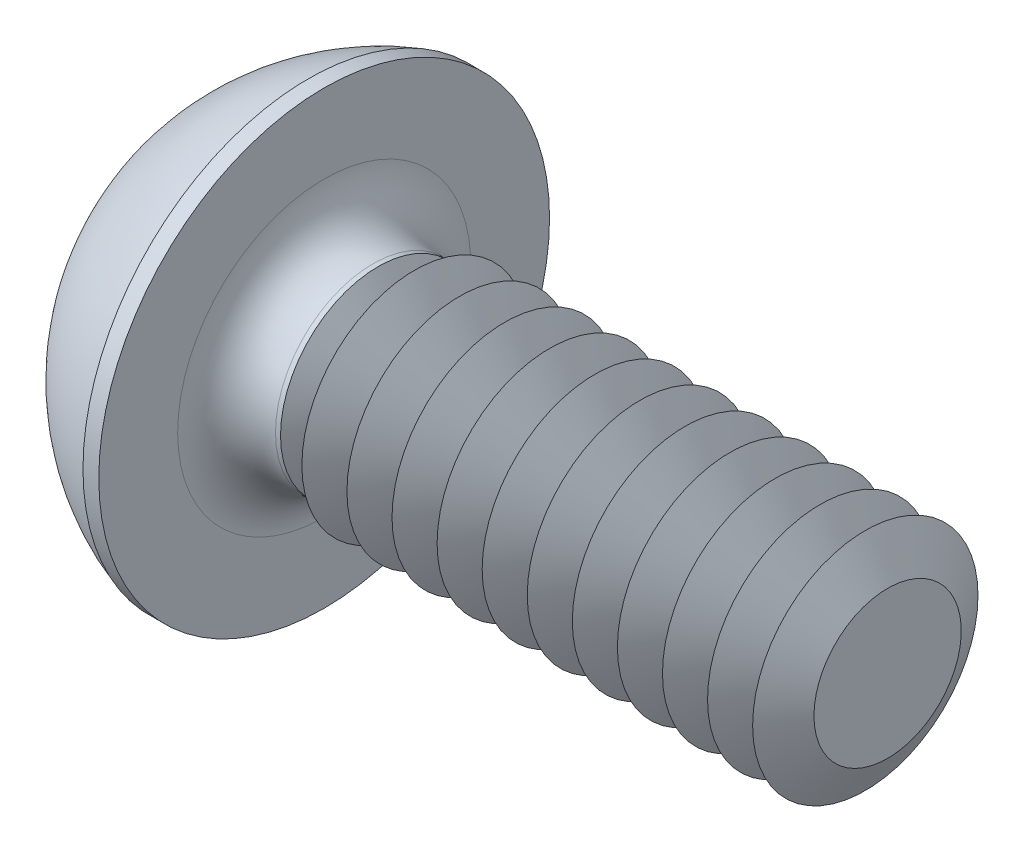
from build123d import *

# Parameters (mm, degrees)
PATTERN_LINEAR_1_COUNT = 12
PATTERN_LINEAR_1_PITCH = 0.4


with BuildPart() as part:
    # 草图2 → Revolve 808 (revolve)
    with BuildSketch(Plane.XY, mode=Mode.PRIVATE) as revolve_808_sk:
        with BuildLine():
            Line((0, 0), (6.6, 0))
            Line((6.6, 0), (6.6, 1))
            Line((6.6, 1), (2.4, 1))
            Line((2.4, 1), (2.266, 0.866))
            Line((2.266, 0.866), (2.034, 0.866))
            ThreePointArc((2.034, 0.866), (1.727115657, 0.993115657), (1.6, 1.3))
            Line((1.6, 1.3), (1.6, 2))
            Line((1.6, 2), (1.459687576, 2))
            ThreePointArc((1.459687576, 2), (0.40373114, 1.23801129), (0, 0))
        make_face()
    revolve(revolve_808_sk.sketch.rotate(Axis((-1.331757704, 0, 0), (1, 0, 0)), 90), axis=Axis((-1.331757704, 0, 0), (1, 0, 0)))

    # 草图3 → 切除-旋转1 (revolve, cut)
    with BuildSketch(Plane.XY, mode=Mode.PRIVATE) as cut_revolve_1_sk:
        Polygon((6.402166402, 1), (6.802166402, 1), (6.6, 0.6536), align=None)
    cut_revolve_1 = revolve(cut_revolve_1_sk.sketch.rotate(Axis((-0.242766179, 0, 0), (1, 0, 0)), 90), axis=Axis((-0.242766179, 0, 0), (1, 0, 0)), mode=Mode.SUBTRACT)

    # 阵列(线性)1: 切除-旋转1 ×12
    with Locations(*[(-i * PATTERN_LINEAR_1_PITCH, 0, 0) for i in range(1, PATTERN_LINEAR_1_COUNT)]):
        add(cut_revolve_1, mode=Mode.SUBTRACT)

    # 草图5 → 切除-放样1 section 0
    with BuildSketch(Plane(origin=(0, 0, 0), x_dir=(0, 0, -1), z_dir=(1, 0, 0)), mode=Mode.PRIVATE) as loft_1_s0:
        with BuildLine():
            Line((0.2, 0.95), (-0.2, 0.95))
            Line((-0.2, 0.95), (-0.2, -0.95))
            Line((-0.2, -0.95), (0.2, -0.95))
            Line((0.2, -0.95), (0.2, 0.95))
        make_face()
    loft_1 = loft([Vertex(1.2, 0, 0), loft_1_s0.sketch], mode=Mode.SUBTRACT)

    # 镜向1: 切除-放样1 across plane
    add(loft_1.mirror(Plane(origin=(0, 0, 0), x_dir=(0, 0.7071067811865462, 0.7071067811865488), z_dir=(0, -0.7071067811865488, 0.7071067811865462))), mode=Mode.SUBTRACT)


solid = part.part
